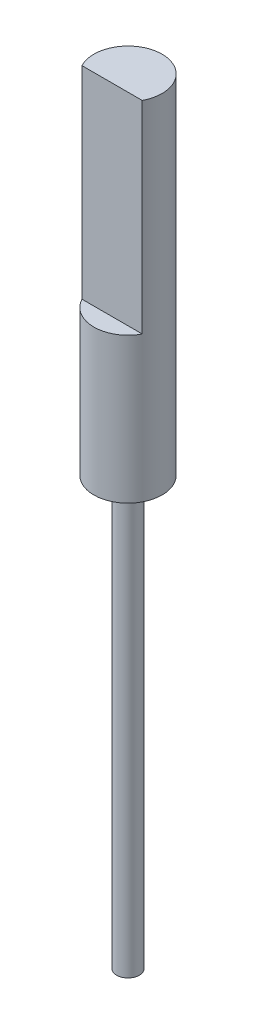
from build123d import *

# Parameters (mm, degrees)
CROQUIS1_R              = 0.5
SALIENTE_EXTRUIR1_DEPTH = 18.8
CROQUIS2_R              = 1.5
SALIENTE_EXTRUIR2_DEPTH = 15.3
CORTAR_EXTRUIR1_START   = -8.9
CORTAR_EXTRUIR1_DEPTH   = 8.9


with BuildPart() as part:
    # Croquis1 → Saliente-Extruir1 (new body)
    with BuildSketch(Plane(origin=(0, 0, 0), x_dir=(1, 0, 0), z_dir=(0, 1, 0))):
        with Locations(Location((0, 0, 0), (0, 0, 270))):
            Circle(CROQUIS1_R)
    extrude(amount=SALIENTE_EXTRUIR1_DEPTH)

    # Croquis2 → Saliente-Extruir2 (add)
    with BuildSketch(Plane(origin=(0, 18.8, 0), x_dir=(1, 0, 0), z_dir=(0, 1, 0))):
        with Locations(Location((0, 0, 0), (0, 0, 270))):
            Circle(CROQUIS2_R)
    extrude(amount=SALIENTE_EXTRUIR2_DEPTH)

    # Croquis3 → Cortar-Extruir1 (cut)
    with BuildSketch(Plane(origin=(0, 34.1, 0), x_dir=(1, 0, 0), z_dir=(0, 1, 0)).offset(CORTAR_EXTRUIR1_START)):
        with BuildLine():
            Line((-1.326649916, -0.7), (1.326649916, -0.7))
            ThreePointArc((1.326649916, -0.7), (0, -1.5), (-1.326649916, -0.7))
        make_face()
    extrude(amount=CORTAR_EXTRUIR1_DEPTH, mode=Mode.SUBTRACT)


solid = part.part
